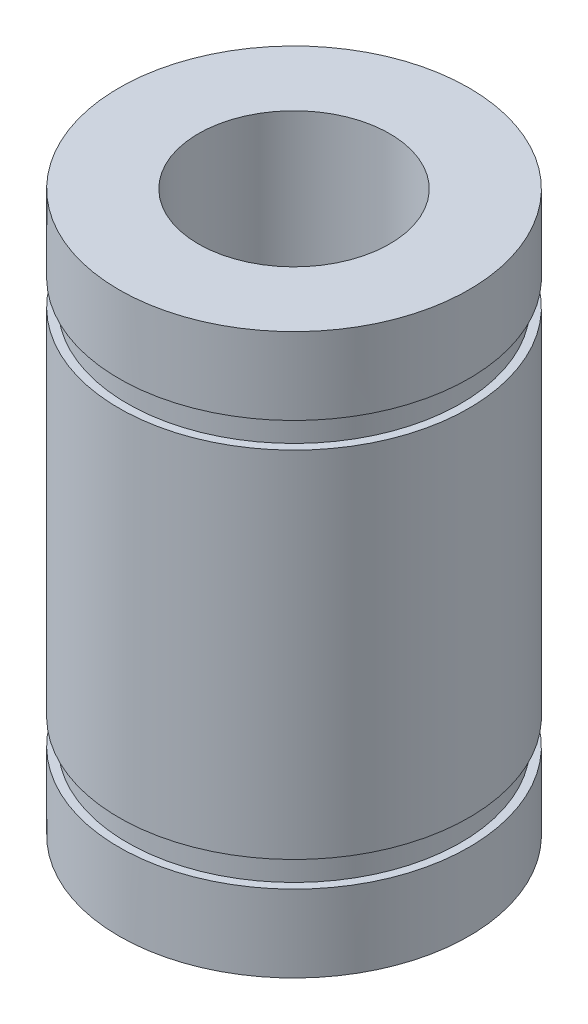
from build123d import *

# Parameters (mm, degrees)
CROQUIS1_R              = 7.5
CROQUIS1_R_2            = 4.1
SALIENTE_EXTRUIR1_DEPTH = 24
CROQUIS2_W              = 0.35
CROQUIS2_H              = 1.1


with BuildPart() as part:
    # Croquis1 → Saliente-Extruir1 (new body)
    with BuildSketch(Plane(origin=(0, 0, 0), x_dir=(1, 0, 0), z_dir=(0, 1, 0))):
        with Locations(Location((0, 0, 0), (0, 0, 270))):
            Circle(CROQUIS1_R)
        with Locations(Location((0, 0, 0), (0, 0, 270))):
            Circle(CROQUIS1_R_2, mode=Mode.SUBTRACT)
    extrude(amount=SALIENTE_EXTRUIR1_DEPTH)

    # Croquis2 → Cortar-Revolución1 (revolve, cut)
    with BuildSketch(Plane.XY, mode=Mode.PRIVATE) as cortar_revoluci_n1_sk:
        with Locations((-7.325, 20.15)):
            Rectangle(CROQUIS2_W, CROQUIS2_H)
        with Locations((-7.325, 3.85)):
            Rectangle(CROQUIS2_W, CROQUIS2_H)
    revolve(cortar_revoluci_n1_sk.sketch.rotate(Axis((0, 0, 0), (0, 1, 0)), 270), axis=Axis((0, 0, 0), (0, 1, 0)), mode=Mode.SUBTRACT)


solid = part.part
